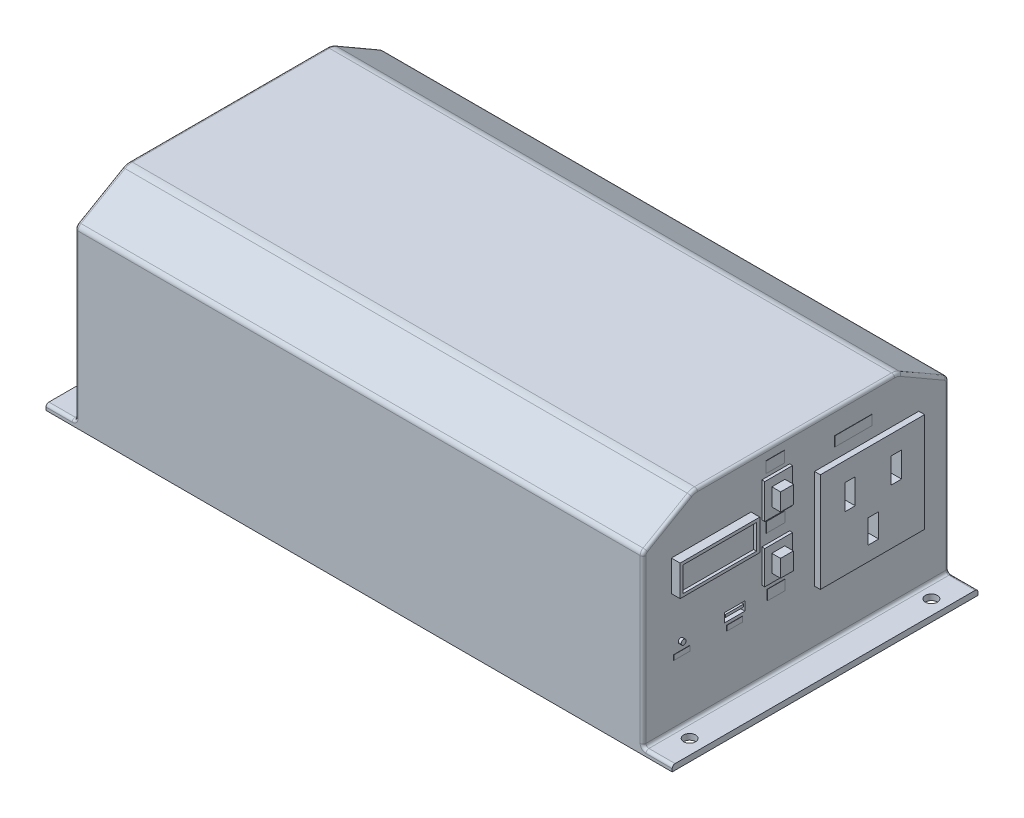
from build123d import *

# Parameters (mm, degrees)
SKETCH_2_W           = 215
SKETCH_2_H           = 105
EXTRUDE_1_DEPTH      = 70
SKETCH_3_W           = 10
SKETCH_3_H           = 105
CUT_EXTRUDE_1_DEPTH  = 68
SKETCH_4_W           = 10
SKETCH_4_H           = 105
CUT_EXTRUDE_2_DEPTH  = 68
CHAMFER_1_SIZE       = 10
CHAMFER_1_SIZE2      = 17.320508076
CHAMFER_2_SIZE       = 10
CHAMFER_2_SIZE2      = 17.320508076
FILLET_3_R           = 5
FILLET_4_R           = 5
FILLET_7_R           = 2
FILLET_8_R           = 2
FILLET_10_R          = 1
FILLET_11_R          = 1
SKETCH_6_R           = 2.05
CUT_EXTRUDE_3_DEPTH  = 2
SKETCH_7_R           = 2.05
CUT_EXTRUDE_4_DEPTH  = 2
SKETCH_8_R           = 2.05
CUT_EXTRUDE_5_DEPTH  = 2
SKETCH_9_R           = 2.05
CUT_EXTRUDE_6_DEPTH  = 2
SKETCH_10_W          = 27.361313109
SKETCH_10_H          = 10.575231448
EXTRUDE_2_DEPTH      = 3
SKETCH_11_W          = 25.186666103
SKETCH_11_H          = 8.53548129
CUT_EXTRUDE_7_DEPTH  = 1
SKETCH_13_W          = 9.542378861
SKETCH_13_H          = 11.886121037
SKETCH_13_H_2        = 11.38389057
EXTRUDE_3_DEPTH      = 1
SKETCH_16_W          = 4.493060974
SKETCH_16_H          = 5.990747966
EXTRUDE_5_DEPTH      = 3
SKETCH_17_W          = 4.416556026
SKETCH_17_H          = 5.913693661
EXTRUDE_6_DEPTH      = 3
SKETCH_18_W          = 6.342904942
SKETCH_18_H          = 3.748080193
EXTRUDE_7_DEPTH      = 0.1
SKETCH_19_W          = 6.357356595
SKETCH_19_H          = 3.496546127
EXTRUDE_8_DEPTH      = 0.1
SKETCH_20_W          = 6.039488765
SKETCH_20_H          = 3.417079169
EXTRUDE_9_DEPTH      = 0.1
SKETCH_21_W          = 35.789770978
SKETCH_21_H          = 34.110106635
EXTRUDE_10_DEPTH     = 2
SKETCH_23_W          = 3.476768395
SKETCH_23_H          = 8.65493409
SKETCH_23_W_2        = 3.55074219
SKETCH_23_W_3        = 3.624715986
SKETCH_23_H_2        = 8.13711752
CUT_EXTRUDE_9_DEPTH  = 20
SKETCH_25_W          = 7.012616737
SKETCH_25_H          = 0.719242742
SKETCH_25_H_2        = 1.438485485
CUT_EXTRUDE_11_DEPTH = 16
SKETCH_26_W          = 0.383681078
SKETCH_26_H          = 0.899053428
SKETCH_26_W_2        = 0.390551653
CUT_EXTRUDE_12_DEPTH = 16
SKETCH_27_W          = 5.352440567
SKETCH_27_H          = 1.72925003
EXTRUDE_11_DEPTH     = 0.1
SKETCH_28_R          = 0.85543485
EXTRUDE_12_DEPTH     = 1
SKETCH_29_W          = 5.57902736
SKETCH_29_H          = 1.653045143
EXTRUDE_13_DEPTH     = 0.1
SKETCH_30_W          = 12.77568276
SKETCH_30_H          = 3.329420356
EXTRUDE_14_DEPTH     = 0.1
SKETCH_31_R          = 3.5
EXTRUDE_15_DEPTH     = 10
SKETCH_32_R          = 3.5
EXTRUDE_16_DEPTH     = 10
SKETCH_33_W          = 15.303302536
SKETCH_33_H          = 4.156452541
EXTRUDE_17_DEPTH     = 0.1
SKETCH_34_W          = 0.871566122
SKETCH_34_H          = 39.547312782
CUT_EXTRUDE_13_DEPTH = 10
SKETCH_35_W          = 0.891435745
SKETCH_35_H          = 39.025075938
CUT_EXTRUDE_14_DEPTH = 10


with BuildPart() as part:
    # 草图2 → 凸台-拉伸1 (new body)
    with BuildSketch(Plane(origin=(0, 0, 0), x_dir=(1, 0, 0), z_dir=(0, 1, 0))):
        Rectangle(SKETCH_2_W, SKETCH_2_H)
    extrude(amount=EXTRUDE_1_DEPTH)

    # 草图3 → 切除-拉伸1 (cut)
    with BuildSketch(Plane(origin=(0, 70, 0), x_dir=(1, 0, 0), z_dir=(0, 1, 0))):
        with Locations((102.5, 0)):
            Rectangle(SKETCH_3_W, SKETCH_3_H)
    extrude(amount=-CUT_EXTRUDE_1_DEPTH, mode=Mode.SUBTRACT)

    # 草图4 → 切除-拉伸2 (cut)
    with BuildSketch(Plane(origin=(0, 70, 0), x_dir=(1, 0, 0), z_dir=(0, 1, 0))):
        with Locations((-102.5, 0)):
            Rectangle(SKETCH_4_W, SKETCH_4_H)
    extrude(amount=-CUT_EXTRUDE_2_DEPTH, mode=Mode.SUBTRACT)

    # 倒角1
    chamfer_1_edges = [part.edges().sort_by_distance(p)[0] for p in [
        (0, 70, 52.5),
    ]]
    chamfer_1_side = [part.faces().sort_by_distance(p)[0] for p in [
        (0, 34.900657414, 52.5),
    ]]
    chamfer(chamfer_1_edges, length=CHAMFER_1_SIZE, length2=CHAMFER_1_SIZE2, reference=chamfer_1_side[0])

    # 倒角2
    chamfer_2_edges = [part.edges().sort_by_distance(p)[0] for p in [
        (0, 70, -52.5),
    ]]
    chamfer_2_side = [part.faces().sort_by_distance(p)[0] for p in [
        (0, 34.900657414, -52.5),
    ]]
    chamfer(chamfer_2_edges, length=CHAMFER_2_SIZE, length2=CHAMFER_2_SIZE2, reference=chamfer_2_side[0])

    # 圆角3
    fillet_3_edges = [part.edges().sort_by_distance(p)[0] for p in [
        (0, 70, 35.179491924),
    ]]
    fillet(fillet_3_edges, radius=FILLET_3_R)

    # 圆角4
    fillet_4_edges = [part.edges().sort_by_distance(p)[0] for p in [
        (0, 70, -35.179491924),
    ]]
    fillet(fillet_4_edges, radius=FILLET_4_R)

    # 圆角7
    fillet_7_edges = [part.edges().sort_by_distance(p)[0] for p in [
        (0, 60, 52.5),
    ]]
    fillet(fillet_7_edges, radius=FILLET_7_R)

    # 圆角8
    fillet_8_edges = [part.edges().sort_by_distance(p)[0] for p in [
        (0, 60, -52.5),
    ]]
    fillet(fillet_8_edges, radius=FILLET_8_R)

    # 圆角10
    fillet_10_edges = [part.edges().sort_by_distance(p)[0] for p in [
        (97.5, 30.422649731, -52.5),
        (102.5, 2, 52.5),
        (97.5, 2, 0),
        (97.5, 30.422649731, 52.5),
        (102.5, 2, -52.5),
        (97.5, 64.953738644, 43.919872981),
        (97.5, 69.829629131, 35.133841188),
        (97.5, 70, 0),
        (97.5, 69.829629131, -35.133841188),
        (97.5, 59.845299462, 52.232050808),
        (97.5, 64.953738644, -43.919872981),
        (97.5, 59.845299462, -52.232050808),
    ]]
    fillet(fillet_10_edges, radius=FILLET_10_R)

    # 圆角11
    fillet_11_edges = [part.edges().sort_by_distance(p)[0] for p in [
        (-102.5, 2, -52.5),
        (-97.5, 2, 0),
        (-97.5, 30.422649731, -52.5),
        (-102.5, 2, 52.5),
        (-97.5, 30.422649731, 52.5),
        (-97.5, 70, 0),
        (-97.5, 69.829629131, 35.133841188),
        (-97.5, 64.953738644, -43.919872981),
        (-97.5, 69.829629131, -35.133841188),
        (-97.5, 64.953738644, 43.919872981),
        (-97.5, 59.845299462, 52.232050808),
        (-97.5, 59.845299462, -52.232050808),
    ]]
    fillet(fillet_11_edges, radius=FILLET_11_R)

    # 草图6 → 切除-拉伸3 (cut)
    with BuildSketch(Plane(origin=(0, 2, 0), x_dir=(1, 0, 0), z_dir=(0, 1, 0))):
        with Locations(Location((102.5, 41.5, 0), (0, 0, 270))):
            Circle(SKETCH_6_R)
    extrude(amount=-CUT_EXTRUDE_3_DEPTH, mode=Mode.SUBTRACT)

    # 草图7 → 切除-拉伸4 (cut)
    with BuildSketch(Plane(origin=(0, 2, 0), x_dir=(1, 0, 0), z_dir=(0, 1, 0))):
        with Locations(Location((102.5, -41.512507822, 0), (0, 0, 270))):
            Circle(SKETCH_7_R)
    extrude(amount=-CUT_EXTRUDE_4_DEPTH, mode=Mode.SUBTRACT)

    # 草图8 → 切除-拉伸5 (cut)
    with BuildSketch(Plane(origin=(0, 2, 0), x_dir=(1, 0, 0), z_dir=(0, 1, 0))):
        with Locations(Location((-102.5, 41.5, 0), (0, 0, 270))):
            Circle(SKETCH_8_R)
    extrude(amount=-CUT_EXTRUDE_5_DEPTH, mode=Mode.SUBTRACT)

    # 草图9 → 切除-拉伸6 (cut)
    with BuildSketch(Plane(origin=(0, 2, 0), x_dir=(1, 0, 0), z_dir=(0, 1, 0))):
        with Locations(Location((-102.5, -41.5, 0), (0, 0, 270))):
            Circle(SKETCH_9_R)
    extrude(amount=-CUT_EXTRUDE_6_DEPTH, mode=Mode.SUBTRACT)

    # 草图10 → 凸台-拉伸2 (add)
    with BuildSketch(Plane(origin=(97.5, 0, 0), x_dir=(0, 0, -1), z_dir=(1, 0, 0))):
        with Locations((-29.106843077, 48.467622908)):
            Rectangle(SKETCH_10_W, SKETCH_10_H)
    extrude(amount=EXTRUDE_2_DEPTH)

    # 草图11 → 切除-拉伸7 (cut)
    with BuildSketch(Plane(origin=(100.5, 0, 0), x_dir=(0, 0, -1), z_dir=(1, 0, 0))):
        with Locations((-29.166895581, 48.448642636)):
            Rectangle(SKETCH_11_W, SKETCH_11_H)
    extrude(amount=-CUT_EXTRUDE_7_DEPTH, mode=Mode.SUBTRACT)

    # 草图13 → 凸台-拉伸3 (add)
    with BuildSketch(Plane(origin=(97.5, 0, 0), x_dir=(0, 0, -1), z_dir=(1, 0, 0))):
        with Locations((-6.950962561, 55.513721256)):
            Rectangle(SKETCH_13_W, SKETCH_13_H)
        with Locations((-6.950962561, 35.84302799)):
            Rectangle(SKETCH_13_W, SKETCH_13_H_2)
    extrude(amount=EXTRUDE_3_DEPTH)

    # 草图16 → 凸台-拉伸5 (add)
    with BuildSketch(Plane(origin=(98.5, 0, 0), x_dir=(0, 0, -1), z_dir=(1, 0, 0))):
        with Locations((-7.027551717, 55.672189952)):
            Rectangle(SKETCH_16_W, SKETCH_16_H)
    extrude(amount=EXTRUDE_5_DEPTH)

    # 草图17 → 凸台-拉伸6 (add)
    with BuildSketch(Plane(origin=(98.5, 0, 0), x_dir=(0, 0, -1), z_dir=(1, 0, 0))):
        with Locations((-7.090598344, 35.963172724)):
            Rectangle(SKETCH_17_W, SKETCH_17_H)
    extrude(amount=EXTRUDE_6_DEPTH)

    # 草图18 → 凸台-拉伸7 (add)
    with BuildSketch(Plane(origin=(97.5, 0, 0), x_dir=(0, 0, -1), z_dir=(1, 0, 0))):
        with Locations((-7.142766557, 64.573165947)):
            Rectangle(SKETCH_18_W, SKETCH_18_H)
    extrude(amount=EXTRUDE_7_DEPTH)

    # 草图19 → 凸台-拉伸8 (add)
    with BuildSketch(Plane(origin=(97.5, 0, 0), x_dir=(0, 0, -1), z_dir=(1, 0, 0))):
        with Locations((-7.105669232, 46.640447976)):
            Rectangle(SKETCH_19_W, SKETCH_19_H)
    extrude(amount=EXTRUDE_8_DEPTH)

    # 草图20 → 凸台-拉伸9 (add)
    with BuildSketch(Plane(origin=(97.5, 0, 0), x_dir=(0, 0, -1), z_dir=(1, 0, 0))):
        with Locations((-6.867268359, 26.336640352)):
            Rectangle(SKETCH_20_W, SKETCH_20_H)
    extrude(amount=EXTRUDE_9_DEPTH)

    # 草图21 → 凸台-拉伸10 (add)
    with BuildSketch(Plane(origin=(97.5, 0, 0), x_dir=(0, 0, -1), z_dir=(1, 0, 0))):
        with Locations((24.268163477, 37.880668705)):
            Rectangle(SKETCH_21_W, SKETCH_21_H)
    extrude(amount=EXTRUDE_10_DEPTH)

    # 草图23 → 切除-拉伸9 (cut)
    with BuildSketch(Plane(origin=(99.5, 0, 0), x_dir=(0, 0, -1), z_dir=(1, 0, 0))):
        with Locations((16.611514869, 44.047939565)):
            Rectangle(SKETCH_23_W, SKETCH_23_H)
        with Locations((32.478894032, 44.047939565)):
            Rectangle(SKETCH_23_W_2, SKETCH_23_H)
        with Locations((24.600684797, 29.881957701)):
            Rectangle(SKETCH_23_W_3, SKETCH_23_H_2)
    extrude(amount=-CUT_EXTRUDE_9_DEPTH, mode=Mode.SUBTRACT)

    # 草图25 → 切除-拉伸11 (cut)
    with BuildSketch(Plane(origin=(97.5, 0, 0), x_dir=(0, 0, -1), z_dir=(1, 0, 0))):
        with Locations((-21.059510698, 28.043061968)):
            Rectangle(SKETCH_25_W, SKETCH_25_H)
        with Locations((-21.059510698, 26.065144427)):
            Rectangle(SKETCH_25_W, SKETCH_25_H_2)
    extrude(amount=-CUT_EXTRUDE_11_DEPTH, mode=Mode.SUBTRACT)

    # 草图26 → 切除-拉伸12 (cut)
    with BuildSketch(Plane(origin=(97.5, 0, 0), x_dir=(0, 0, -1), z_dir=(1, 0, 0))):
        with Locations((-24.373978527, 27.233913883)):
            Rectangle(SKETCH_26_W, SKETCH_26_H)
        with Locations((-17.748478156, 27.233913883)):
            Rectangle(SKETCH_26_W_2, SKETCH_26_H)
    extrude(amount=-CUT_EXTRUDE_12_DEPTH, mode=Mode.SUBTRACT)

    # 草图27 → 凸台-拉伸11 (add)
    with BuildSketch(Plane(origin=(97.5, 0, 0), x_dir=(0, 0, -1), z_dir=(1, 0, 0))):
        with Locations((-21.113306113, 23.448923117)):
            Rectangle(SKETCH_27_W, SKETCH_27_H)
    extrude(amount=EXTRUDE_11_DEPTH)

    # 草图28 → 凸台-拉伸12 (add)
    with BuildSketch(Plane(origin=(97.5, 0, 0), x_dir=(0, 0, -1), z_dir=(1, 0, 0))):
        with Locations(Location((-39.548635356, 27.615214061, 0), (0, 0, 180))):
            Circle(SKETCH_28_R)
    extrude(amount=EXTRUDE_12_DEPTH)

    # 草图29 → 凸台-拉伸13 (add)
    with BuildSketch(Plane(origin=(97.5, 0, 0), x_dir=(0, 0, -1), z_dir=(1, 0, 0))):
        with Locations((-39.232409184, 23.800905961)):
            Rectangle(SKETCH_29_W, SKETCH_29_H)
    extrude(amount=EXTRUDE_13_DEPTH)

    # 草图30 → 凸台-拉伸14 (add)
    with BuildSketch(Plane(origin=(97.5, 0, 0), x_dir=(0, 0, -1), z_dir=(1, 0, 0))):
        with Locations((19.689254046, 60.447677452)):
            Rectangle(SKETCH_30_W, SKETCH_30_H)
    extrude(amount=EXTRUDE_14_DEPTH)

    # 草图31 → 凸台-拉伸15 (add)
    with BuildSketch(Plane.ZY.offset(97.5)):
        with Locations(Location((-0.808042958, 48.990276182, 0), (0, 0, 180))):
            Circle(SKETCH_31_R)
    extrude(amount=EXTRUDE_15_DEPTH)

    # 草图32 → 凸台-拉伸16 (add)
    with BuildSketch(Plane.ZY.offset(97.5)):
        with Locations(Location((0, 20.336966554, 0), (0, 0, 180))):
            Circle(SKETCH_32_R)
    extrude(amount=EXTRUDE_16_DEPTH)

    # 草图33 → 凸台-拉伸17 (add)
    with BuildSketch(Plane.ZY.offset(97.5)):
        with Locations((-1.066479639, 33.431538811)):
            Rectangle(SKETCH_33_W, SKETCH_33_H)
    extrude(amount=EXTRUDE_17_DEPTH)

    # 草图34 → 切除-拉伸13 (cut)
    with BuildSketch(Plane.ZY.offset(97.5)):
        with Locations((-44.565367715, 32.428325845)):
            Rectangle(SKETCH_34_W, SKETCH_34_H)
        with Locations((-46.565367715, 32.428325845)):
            Rectangle(SKETCH_34_W, SKETCH_34_H)
        with Locations((-42.565367715, 32.428325845)):
            Rectangle(SKETCH_34_W, SKETCH_34_H)
        with Locations((-40.565367715, 32.428325845)):
            Rectangle(SKETCH_34_W, SKETCH_34_H)
        with Locations((-38.565367715, 32.428325845)):
            Rectangle(SKETCH_34_W, SKETCH_34_H)
        with Locations((-36.565367715, 32.428325845)):
            Rectangle(SKETCH_34_W, SKETCH_34_H)
        with Locations((-34.565367715, 32.428325845)):
            Rectangle(SKETCH_34_W, SKETCH_34_H)
        with Locations((-32.565367715, 32.428325845)):
            Rectangle(SKETCH_34_W, SKETCH_34_H)
        with Locations((-30.565367715, 32.428325845)):
            Rectangle(SKETCH_34_W, SKETCH_34_H)
        with Locations((-28.565367715, 32.428325845)):
            Rectangle(SKETCH_34_W, SKETCH_34_H)
        with Locations((-26.565367715, 32.428325845)):
            Rectangle(SKETCH_34_W, SKETCH_34_H)
        with Locations((-24.565367715, 32.428325845)):
            Rectangle(SKETCH_34_W, SKETCH_34_H)
        with Locations((-22.565367715, 32.428325845)):
            Rectangle(SKETCH_34_W, SKETCH_34_H)
        with Locations((-20.565367715, 32.428325845)):
            Rectangle(SKETCH_34_W, SKETCH_34_H)
        with Locations((-18.565367715, 32.428325845)):
            Rectangle(SKETCH_34_W, SKETCH_34_H)
        with Locations((-16.565367715, 32.428325845)):
            Rectangle(SKETCH_34_W, SKETCH_34_H)
        with Locations((-14.565367715, 32.428325845)):
            Rectangle(SKETCH_34_W, SKETCH_34_H)
    extrude(amount=-CUT_EXTRUDE_13_DEPTH, mode=Mode.SUBTRACT)

    # 草图35 → 切除-拉伸14 (cut)
    with BuildSketch(Plane.ZY.offset(97.5)):
        with Locations((16.621710968, 32.440680187)):
            Rectangle(SKETCH_35_W, SKETCH_35_H)
        with Locations((14.621710968, 32.440680187)):
            Rectangle(SKETCH_35_W, SKETCH_35_H)
        with Locations((18.621710968, 32.440680187)):
            Rectangle(SKETCH_35_W, SKETCH_35_H)
        with Locations((20.621710968, 32.440680187)):
            Rectangle(SKETCH_35_W, SKETCH_35_H)
        with Locations((22.621710968, 32.440680187)):
            Rectangle(SKETCH_35_W, SKETCH_35_H)
        with Locations((24.621710968, 32.440680187)):
            Rectangle(SKETCH_35_W, SKETCH_35_H)
        with Locations((26.621710968, 32.440680187)):
            Rectangle(SKETCH_35_W, SKETCH_35_H)
        with Locations((28.621710968, 32.440680187)):
            Rectangle(SKETCH_35_W, SKETCH_35_H)
        with Locations((30.621710968, 32.440680187)):
            Rectangle(SKETCH_35_W, SKETCH_35_H)
        with Locations((32.621710968, 32.440680187)):
            Rectangle(SKETCH_35_W, SKETCH_35_H)
        with Locations((34.621710968, 32.440680187)):
            Rectangle(SKETCH_35_W, SKETCH_35_H)
        with Locations((36.621710968, 32.440680187)):
            Rectangle(SKETCH_35_W, SKETCH_35_H)
        with Locations((38.621710968, 32.440680187)):
            Rectangle(SKETCH_35_W, SKETCH_35_H)
        with Locations((40.621710968, 32.440680187)):
            Rectangle(SKETCH_35_W, SKETCH_35_H)
        with Locations((42.621710968, 32.440680187)):
            Rectangle(SKETCH_35_W, SKETCH_35_H)
        with Locations((44.621710968, 32.440680187)):
            Rectangle(SKETCH_35_W, SKETCH_35_H)
        with Locations((46.621710968, 32.440680187)):
            Rectangle(SKETCH_35_W, SKETCH_35_H)
    extrude(amount=-CUT_EXTRUDE_14_DEPTH, mode=Mode.SUBTRACT)


solid = part.part
